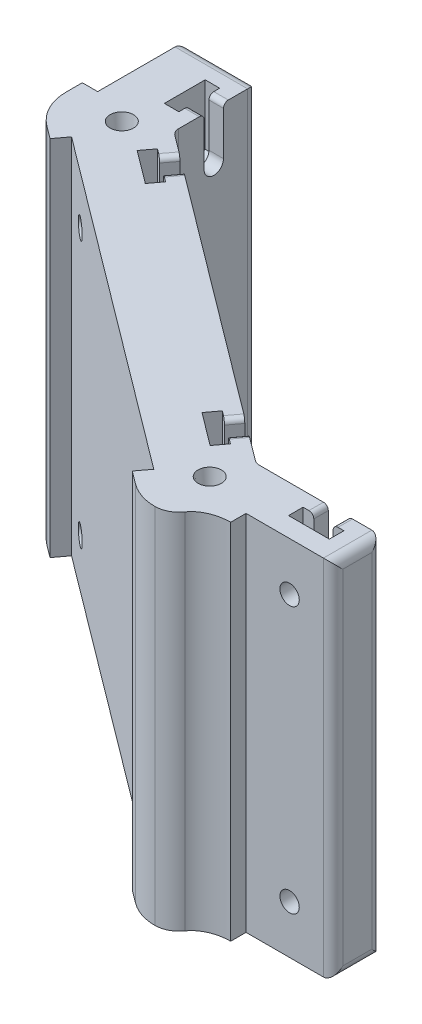
from build123d import *

# Parameters (mm, degrees)
BOSS_EXTRUDE1_DEPTH          = 75
SKETCH2_R                    = 2
CUT_EXTRUDE1_DEPTH           = 10
SKETCH3_R                    = 2
CUT_EXTRUDE2_DEPTH           = 15
SKETCH4_R                    = 2
CUT_EXTRUDE3_DEPTH           = 15
CUT_EXTRUDE5_START           = -3
CUT_EXTRUDE5_DEPTH           = 3
CUT_EXTRUDE6_START           = -3
CUT_EXTRUDE6_DEPTH           = 3
CUT_EXTRUDE7_START           = -3
CUT_EXTRUDE7_DEPTH           = 3
CUT_EXTRUDE8_START           = -3
CUT_EXTRUDE8_DEPTH           = 3
CUT_EXTRUDE9_START           = -3
CUT_EXTRUDE9_DEPTH           = 3
SKETCH5_R                    = 2.413
CUT_EXTRUDE4_DEPTH           = 6.35
CUT_EXTRUDE4_DRAFT           = -8
CUT_EXTRUDE4_PROFILE_2_DEPTH = 6.35
CUT_EXTRUDE4_PROFILE_2_DRAFT = -8
CUT_EXTRUDE10_START          = -3
CUT_EXTRUDE10_DEPTH          = 3
SKETCH14_R                   = 1.5205657
CUT_EXTRUDE12_DEPTH          = 5
MIRROR1_COPY_1_SKETCH_R      = 2.413
MIRROR1_COPY_1_DEPTH         = 6.35
MIRROR1_COPY_1_DRAFT         = -8
MIRROR1_COPY_2_SKETCH_R      = 2.413
MIRROR1_COPY_2_DEPTH         = 6.35
MIRROR1_COPY_2_DRAFT         = -8
MIRROR1_COPY_3_SKETCH_R      = 2.413
MIRROR1_COPY_3_DEPTH         = 6.35
MIRROR1_COPY_3_DRAFT         = -8
FILLET1_R                    = 1
FILLET2_R                    = 2


with BuildPart() as part:
    # Sketch1 → Boss-Extrude1 (new body)
    with BuildSketch(Plane(origin=(0, 0, 0), x_dir=(1, 0, 0), z_dir=(0, 1, 0))):
        with BuildLine():
            Line((-18.028333333, 23.74), (2.725, 8.175))
            Line((2.725, 8.175), (28.666666667, 8.175))
            Line((28.666666667, 8.175), (28.666666667, -1.825))
            Line((28.666666667, -1.825), (10.666666667, -1.825))
            Line((10.666666667, -1.825), (10.666666667, -5))
            add(Edge.make_bspline(
                [(10.666666667, -5), (6.082964765, -5), (4.109838042, -7.8476712)],
                knots=[4.71238898, 4.71238898, 4.71238898, 5.838176577, 5.838176577, 5.838176577], degree=2, weights=[1, 0.84571442, 1]))
            ThreePointArc((4.109838042, -7.8476712), (2.319659889, -9.429354129), (0, -10))
            ThreePointArc((0, -10), (-3.16227766, -9.486832981), (-6, -8))
            Line((-6, -8), (-8.666666667, -6))
            Line((-8.666666667, -6), (-6.761666667, -3.46))
            Line((-6.761666667, -3.46), (-74.761666667, 47.54))
            Line((-74.761666667, 47.54), (-76.666666667, 45))
            Line((-76.666666667, 45), (-79.333333333, 47))
            ThreePointArc((-79.333333333, 47), (-82.277605243, 50.527864045), (-83.333333333, 55))
            Line((-83.333333333, 55), (-83.333333333, 58.333333333))
            Line((-83.333333333, 58.333333333), (-80.158333333, 58.333333333))
            Line((-80.158333333, 58.333333333), (-80.158333333, 76.333333333))
            Line((-80.158333333, 76.333333333), (-65.158333333, 76.333333333))
            Line((-65.158333333, 76.333333333), (-65.158333333, 59.0875))
            Line((-65.158333333, 59.0875), (-51.361666667, 48.74))
            Line((-51.361666667, 48.74), (-18.028333333, 23.74))
        make_face()
    extrude(amount=BOSS_EXTRUDE1_DEPTH)

    # Sketch2 → Cut-Extrude1 (cut)
    with BuildSketch(Plane.XY.offset(1.825)):
        with Locations((19.666666667, 10)):
            Circle(SKETCH2_R)
        with Locations((19.666666667, 65)):
            Circle(SKETCH2_R)
    extrude(amount=-CUT_EXTRUDE1_DEPTH, mode=Mode.SUBTRACT)

    # Sketch3 → Cut-Extrude2 (cut)
    with BuildSketch(Plane(origin=(-4.095, 0, 5.46), x_dir=(0.8000000000000002, 0, 0.5999999999999999), z_dir=(-0.5999999999999999, 0, 0.8000000000000003))):
        with Locations((-12.333333333, 10)):
            Circle(SKETCH3_R)
        with Locations((-12.333333333, 65)):
            Circle(SKETCH3_R)
        with Locations((-79.333333333, 10)):
            Circle(SKETCH3_R)
        with Locations((-79.333333333, 65)):
            Circle(SKETCH3_R)
    extrude(amount=-CUT_EXTRUDE2_DEPTH, mode=Mode.SUBTRACT)

    # Sketch4 → Cut-Extrude3 (cut)
    with BuildSketch(Plane.ZY.offset(80.158333333)):
        with Locations((-67.333333333, 10)):
            Circle(SKETCH4_R)
        with Locations((-67.333333333, 65)):
            Circle(SKETCH4_R)
    extrude(amount=-CUT_EXTRUDE3_DEPTH, mode=Mode.SUBTRACT)

    # Sketch6 → Cut-Extrude5 (cut)
    with BuildSketch(Plane(origin=(4.905, 0, -6.54), x_dir=(-0.8000000000000002, 0, -0.6), z_dir=(0.6, 0, -0.8000000000000002)).offset(CUT_EXTRUDE5_START)):
        Polygon((8.114583333, 62.564303552), (12.333333333, 60.128607104), (16.552083333, 62.564303552), (16.552083333, 75), (8.114583333, 75), align=None)
        Polygon((75.114583333, 62.564303552), (79.333333333, 60.128607104), (83.552083333, 62.564303552), (83.552083333, 75), (75.114583333, 75), align=None)
        Polygon((8.114583333, 12.435696448), (12.333333333, 14.871392896), (16.552083333, 12.435696448), (16.552083333, 0), (8.114583333, 0), align=None)
        Polygon((75.114583333, 12.435696448), (79.333333333, 14.871392896), (83.552083333, 12.435696448), (83.552083333, 0), (75.114583333, 0), align=None)
    extrude(amount=-CUT_EXTRUDE5_DEPTH, mode=Mode.SUBTRACT)

    # Sketch7 → Cut-Extrude6 (cut)
    with BuildSketch(Plane(origin=(4.905, 0, -6.54), x_dir=(-0.8000000000000002, 0, -0.6), z_dir=(0.6, 0, -0.8000000000000002)).offset(CUT_EXTRUDE6_START)):
        with BuildLine():
            Line((14.333333333, 65), (14.333333333, 75))
            Line((14.333333333, 75), (10.333333333, 75))
            Line((10.333333333, 75), (10.333333333, 65))
            ThreePointArc((10.333333333, 65), (12.333333333, 67), (14.333333333, 65))
        make_face()
        with BuildLine():
            Line((81.333333333, 65), (81.333333333, 75))
            Line((81.333333333, 75), (77.333333333, 75))
            Line((77.333333333, 75), (77.333333333, 65))
            ThreePointArc((77.333333333, 65), (79.333333333, 67), (81.333333333, 65))
        make_face()
        with BuildLine():
            Line((81.333333333, 0), (77.333333333, 0))
            Line((77.333333333, 0), (77.333333333, 10))
            ThreePointArc((77.333333333, 10), (79.333333333, 8), (81.333333333, 10))
            Line((81.333333333, 10), (81.333333333, 0))
        make_face()
        with BuildLine():
            Line((14.333333333, 0), (10.333333333, 0))
            Line((10.333333333, 0), (10.333333333, 10))
            ThreePointArc((10.333333333, 10), (12.333333333, 8), (14.333333333, 10))
            Line((14.333333333, 10), (14.333333333, 0))
        make_face()
    extrude(amount=CUT_EXTRUDE6_DEPTH, mode=Mode.SUBTRACT)

    # Sketch8 → Cut-Extrude7 (cut)
    with BuildSketch(Plane(origin=(0, 0, -8.175), x_dir=(-1, 0, 0), z_dir=(0, 0, -1)).offset(CUT_EXTRUDE7_START)):
        Polygon((-23.885416667, 0), (-23.885416667, 12.435696448), (-19.666666667, 14.871392896), (-15.447916667, 12.435696448), (-15.447916667, 0), align=None)
        Polygon((-23.885416667, 62.564303552), (-19.666666667, 60.128607104), (-15.447916667, 62.564303552), (-15.447916667, 75), (-23.885416667, 75), align=None)
    extrude(amount=-CUT_EXTRUDE7_DEPTH, mode=Mode.SUBTRACT)

    # Sketch9 → Cut-Extrude8 (cut)
    with BuildSketch(Plane(origin=(0, 0, -8.175), x_dir=(-1, 0, 0), z_dir=(0, 0, -1)).offset(CUT_EXTRUDE8_START)):
        with BuildLine():
            Line((-17.666666667, 65), (-17.666666667, 75))
            Line((-17.666666667, 75), (-21.666666667, 75))
            Line((-21.666666667, 75), (-21.666666667, 65))
            ThreePointArc((-21.666666667, 65), (-19.666666667, 67), (-17.666666667, 65))
        make_face()
        with BuildLine():
            Line((-21.666666667, 10), (-21.666666667, 0))
            Line((-21.666666667, 0), (-17.666666667, 0))
            Line((-17.666666667, 0), (-17.666666667, 10))
            ThreePointArc((-17.666666667, 10), (-19.666666667, 8), (-21.666666667, 10))
        make_face()
    extrude(amount=CUT_EXTRUDE8_DEPTH, mode=Mode.SUBTRACT)

    # Sketch10 → Cut-Extrude9 (cut)
    with BuildSketch(Plane(origin=(-65.158333333, 0, 0), x_dir=(0, 0, -1), z_dir=(1, 0, 0)).offset(CUT_EXTRUDE9_START)):
        Polygon((63.114583333, 62.564303552), (67.333333333, 60.128607104), (71.552083333, 62.564303552), (71.552083333, 75), (63.114583333, 75), align=None)
        Polygon((63.114583333, 12.435696448), (67.333333333, 14.871392896), (71.552083333, 12.435696448), (71.552083333, 0), (63.114583333, 0), align=None)
    extrude(amount=-CUT_EXTRUDE9_DEPTH, mode=Mode.SUBTRACT)


with BuildPart() as cut_extrude4_tool:
    # Sketch5 → Cut-Extrude4 (with draft: the straight prism first)
    with BuildSketch(Plane(origin=(0, 75, 0), x_dir=(1, 0, 0), z_dir=(0, 1, 0))):
        with Locations((0.333333333, 1)):
            Circle(SKETCH5_R)
    extrude(amount=-CUT_EXTRUDE4_DEPTH)
    # Cut-Extrude4: the draft: its side faces are tilted about the plane it starts from
    cut_extrude4_sides = [cut_extrude4_tool.faces().sort_by_distance(p)[0] for p in [
        (-2.079666667, 71.825, -1),
    ]]
    draft(cut_extrude4_sides, Plane(origin=(0, 75, 0), x_dir=(1, 0, 0), z_dir=(0, 1, 0)), CUT_EXTRUDE4_DRAFT)


with BuildPart() as part_1:
    add(part.part)

    # Cut-Extrude4: cut by cut_extrude4_tool
    add(cut_extrude4_tool.part, mode=Mode.SUBTRACT)


with BuildPart() as cut_extrude4_profile_2_tool:
    # Sketch5 → Cut-Extrude4 profile 2 (with draft: the straight prism first)
    with BuildSketch(Plane(origin=(0, 75, 0), x_dir=(1, 0, 0), z_dir=(0, 1, 0))):
        with Locations((-72.333333333, 55.5)):
            Circle(SKETCH5_R)
    extrude(amount=-CUT_EXTRUDE4_PROFILE_2_DEPTH)
    # Cut-Extrude4 profile 2: the draft: its side faces are tilted about the plane it starts from
    cut_extrude4_profile_2_sides = [cut_extrude4_profile_2_tool.faces().sort_by_distance(p)[0] for p in [
        (-74.746333333, 71.825, -55.5),
    ]]
    draft(cut_extrude4_profile_2_sides, Plane(origin=(0, 75, 0), x_dir=(1, 0, 0), z_dir=(0, 1, 0)), CUT_EXTRUDE4_PROFILE_2_DRAFT)


with BuildPart() as part_2:
    add(part_1.part)

    # Cut-Extrude4 profile 2: cut by cut_extrude4_profile_2_tool
    add(cut_extrude4_profile_2_tool.part, mode=Mode.SUBTRACT)

    # Sketch11 → Cut-Extrude10 (cut)
    with BuildSketch(Plane(origin=(-65.158333333, 0, 0), x_dir=(0, 0, -1), z_dir=(1, 0, 0)).offset(CUT_EXTRUDE10_START)):
        with BuildLine():
            Line((69.333333333, 65), (69.333333333, 75))
            Line((69.333333333, 75), (65.333333333, 75))
            Line((65.333333333, 75), (65.333333333, 65))
            ThreePointArc((65.333333333, 65), (67.333333333, 67), (69.333333333, 65))
        make_face()
        with BuildLine():
            Line((69.333333333, 10), (69.333333333, 0))
            Line((69.333333333, 0), (65.333333333, 0))
            Line((65.333333333, 0), (65.333333333, 10))
            ThreePointArc((65.333333333, 10), (67.333333333, 8), (69.333333333, 10))
        make_face()
    extrude(amount=CUT_EXTRUDE10_DEPTH, mode=Mode.SUBTRACT)

    # Sketch14 → Cut-Extrude12 (cut)
    with BuildSketch(Plane(origin=(0, 68.65, 0), x_dir=(1, 0, 0), z_dir=(0, 1, 0))):
        with Locations(Location((-72.333333333, 55.5, 0), (0, 0, 270))):
            Circle(SKETCH14_R)
        with Locations(Location((0.333333333, 1, 0), (0, 0, 270))):
            Circle(SKETCH14_R)
    cut_extrude12 = extrude(amount=-CUT_EXTRUDE12_DEPTH, mode=Mode.SUBTRACT)

    # Mirror1: Cut-Extrude12 across plane
    add(cut_extrude12.mirror(Plane.ZX.offset(37.5)), mode=Mode.SUBTRACT)


with BuildPart() as mirror1_copy_1_tool:
    # Mirror1 copy 1 sketch → Mirror1 copy 1 (with draft: the straight prism first)
    with BuildSketch(Plane.XZ):
        with Locations((0.333333333, -1)):
            Circle(MIRROR1_COPY_1_SKETCH_R)
    extrude(amount=-MIRROR1_COPY_1_DEPTH)
    # Mirror1 copy 1: the draft: its side faces are tilted about the plane it starts from
    mirror1_copy_1_sides = [mirror1_copy_1_tool.faces().sort_by_distance(p)[0] for p in [
        (-2.079666667, 3.175, -1),
    ]]
    draft(mirror1_copy_1_sides, Plane.XZ, MIRROR1_COPY_1_DRAFT)


with BuildPart() as part_3:
    add(part_2.part)

    # Mirror1 copy 1: cut by mirror1_copy_1_tool
    add(mirror1_copy_1_tool.part, mode=Mode.SUBTRACT)


with BuildPart() as mirror1_copy_2_tool:
    # Mirror1 copy 2 sketch → Mirror1 copy 2 (with draft: the straight prism first)
    with BuildSketch(Plane.XZ):
        with Locations((-72.333333333, -55.5)):
            Circle(MIRROR1_COPY_2_SKETCH_R)
    extrude(amount=-MIRROR1_COPY_2_DEPTH)
    # Mirror1 copy 2: the draft: its side faces are tilted about the plane it starts from
    mirror1_copy_2_sides = [mirror1_copy_2_tool.faces().sort_by_distance(p)[0] for p in [
        (-74.746333333, 3.175, -55.5),
    ]]
    draft(mirror1_copy_2_sides, Plane.XZ, MIRROR1_COPY_2_DRAFT)


with BuildPart() as part_4:
    add(part_3.part)

    # Mirror1 copy 2: cut by mirror1_copy_2_tool
    add(mirror1_copy_2_tool.part, mode=Mode.SUBTRACT)


with BuildPart() as mirror1_copy_3_tool:
    # Mirror1 copy 3 sketch → Mirror1 copy 3 (with draft: the straight prism first)
    with BuildSketch(Plane.XZ):
        with Locations((-72.333333333, -55.5)):
            Circle(MIRROR1_COPY_3_SKETCH_R)
    extrude(amount=-MIRROR1_COPY_3_DEPTH)
    # Mirror1 copy 3: the draft: its side faces are tilted about the plane it starts from
    mirror1_copy_3_sides = [mirror1_copy_3_tool.faces().sort_by_distance(p)[0] for p in [
        (-74.746333333, 3.175, -55.5),
    ]]
    draft(mirror1_copy_3_sides, Plane.XZ, MIRROR1_COPY_3_DRAFT)


with BuildPart() as part_5:
    add(part_4.part)

    # Mirror1 copy 3: cut by mirror1_copy_3_tool
    add(mirror1_copy_3_tool.part, mode=Mode.SUBTRACT)

    # Fillet1
    fillet1_edges = [part_5.edges().sort_by_distance(p)[0] for p in [
        (-7.461666667, 0, -13.94),
        (-4.261666667, 0, -11.54),
        (-61.061666667, 0, -54.14),
        (-57.861666667, 0, -51.74),
        (-57.861666667, 75, -51.74),
        (-61.061666667, 75, -54.14),
        (-4.261666667, 75, -11.54),
        (-7.461666667, 75, -13.94),
        (21.666666667, 75, -6.675),
        (17.666666667, 75, -6.675),
        (17.666666667, 0, -6.675),
        (21.666666667, 0, -6.675),
        (-66.658333333, 75, -65.333333333),
        (-66.658333333, 75, -69.333333333),
        (-66.658333333, 0, -69.333333333),
        (-66.658333333, 0, -65.333333333),
    ]]
    fillet(fillet1_edges, radius=FILLET1_R)

    # Fillet2
    fillet2_edges = [part_5.edges().sort_by_distance(p)[0] for p in [
        (28.666666667, 75, -3.175),
        (-72.658333333, 0, -76.333333333),
        (28.666666667, 0, -3.175),
        (-80.158333333, 37.5, -76.333333333),
        (-65.158333333, 37.5, -76.333333333),
        (-65.158333333, 37.5, -59.0875),
        (2.725, 37.5, -8.175),
        (28.666666667, 37.5, -8.175),
        (28.666666667, 37.5, 1.825),
        (-72.658333333, 75, -76.333333333),
    ]]
    fillet(fillet2_edges, radius=FILLET2_R)


solid = part_5.part
